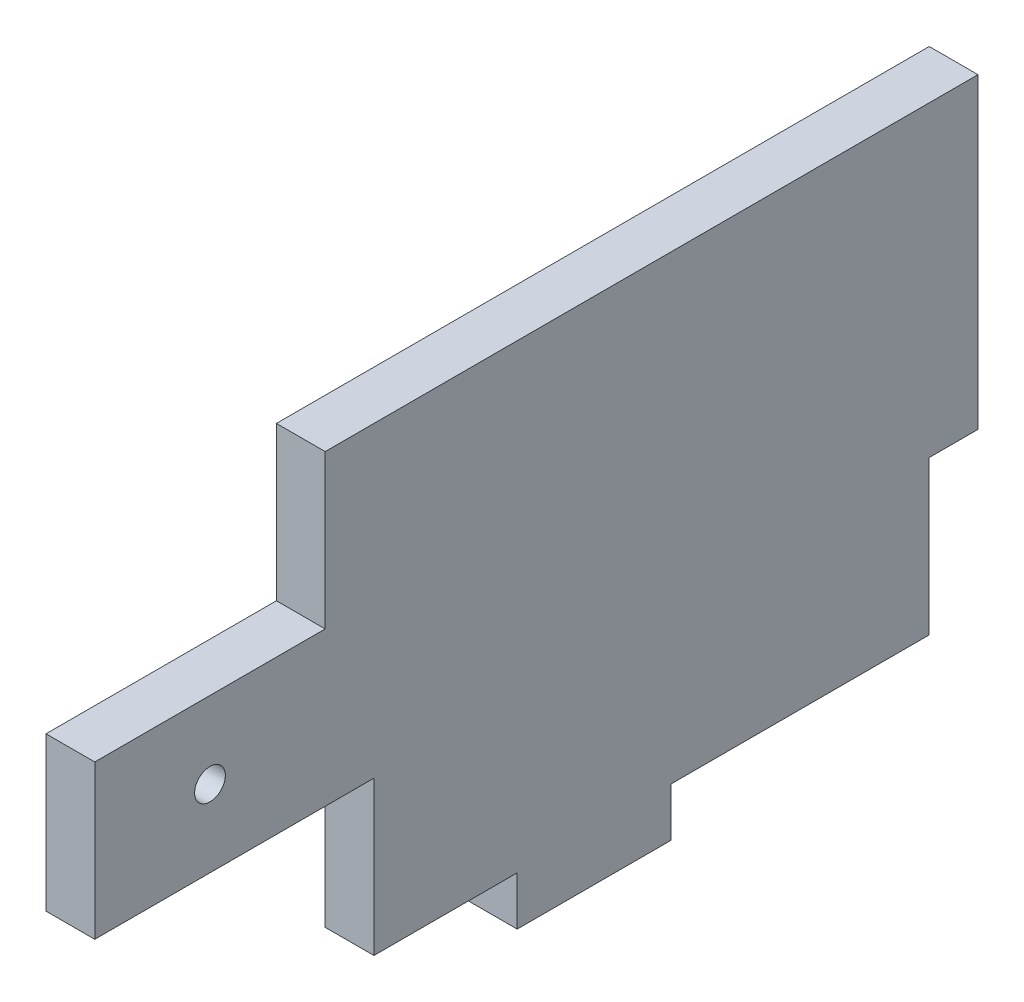
from build123d import *

# Parameters (mm, degrees)
SKETCH1_W           = 170
SKETCH1_H           = 120
SKETCH1_W_2         = 40
SKETCH1_H_2         = 12.7
SKETCH1_W_3         = 60
SKETCH1_H_3         = 40
BOSS_EXTRUDE1_DEPTH = 12.7
SKETCH2_R           = 4
SKETCH2_W           = 12.7
SKETCH2_H           = 40
CUT_EXTRUDE1_DEPTH  = 12.7


with BuildPart() as part:
    # Sketch1 → Boss-Extrude1 (new body)
    with BuildSketch(Plane(origin=(0, 0, 0), x_dir=(0, 0, -1), z_dir=(1, 0, 0))):
        Rectangle(SKETCH1_W, SKETCH1_H)
        with Locations((-15, -66.35)):
            Rectangle(SKETCH1_W_2, SKETCH1_H_2)
        with Locations((-115, 0)):
            Rectangle(SKETCH1_W_3, SKETCH1_H_3)
    extrude(amount=BOSS_EXTRUDE1_DEPTH)

    # Sketch2 → Cut-Extrude1 (cut)
    with BuildSketch(Plane(origin=(12.7, 0, 0), x_dir=(0, 0, -1), z_dir=(1, 0, 0))):
        with Locations((-115, 0)):
            Circle(SKETCH2_R)
        with Locations((-78.65, -40)):
            Rectangle(SKETCH2_W, SKETCH2_H)
        with Locations((78.65, -40)):
            Rectangle(SKETCH2_W, SKETCH2_H)
    extrude(amount=-CUT_EXTRUDE1_DEPTH, mode=Mode.SUBTRACT)


solid = part.part
